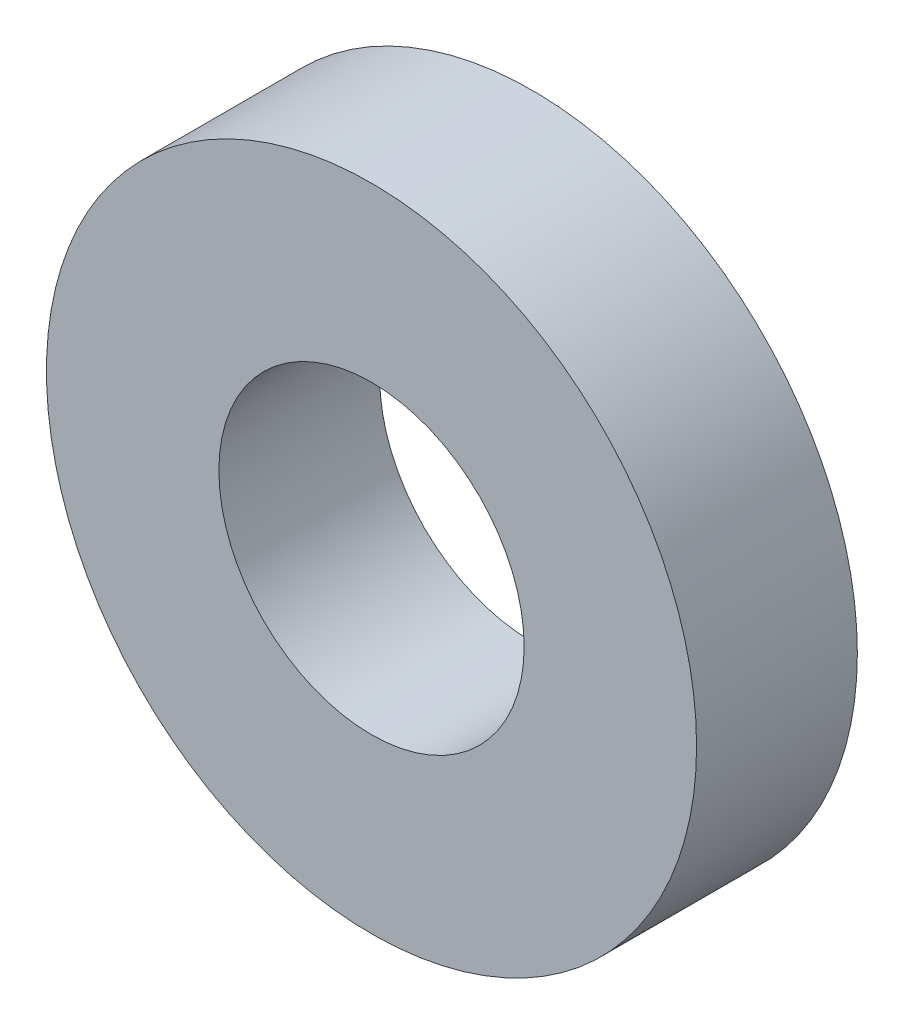
from build123d import *

# Parameters (mm, degrees)
CURVESKETCH_R   = 23.719
CURVESKETCH_R_2 = 11.137
CURVEBOSS_DEPTH = 11.731


with BuildPart() as part:
    # CurveSketch → CurveBoss (new body)
    with BuildSketch(Plane.XY):
        with Locations((5.371, -7.193)):
            Circle(CURVESKETCH_R)
        with Locations((5.371, -7.193)):
            Circle(CURVESKETCH_R_2, mode=Mode.SUBTRACT)
    extrude(amount=CURVEBOSS_DEPTH)


solid = part.part
